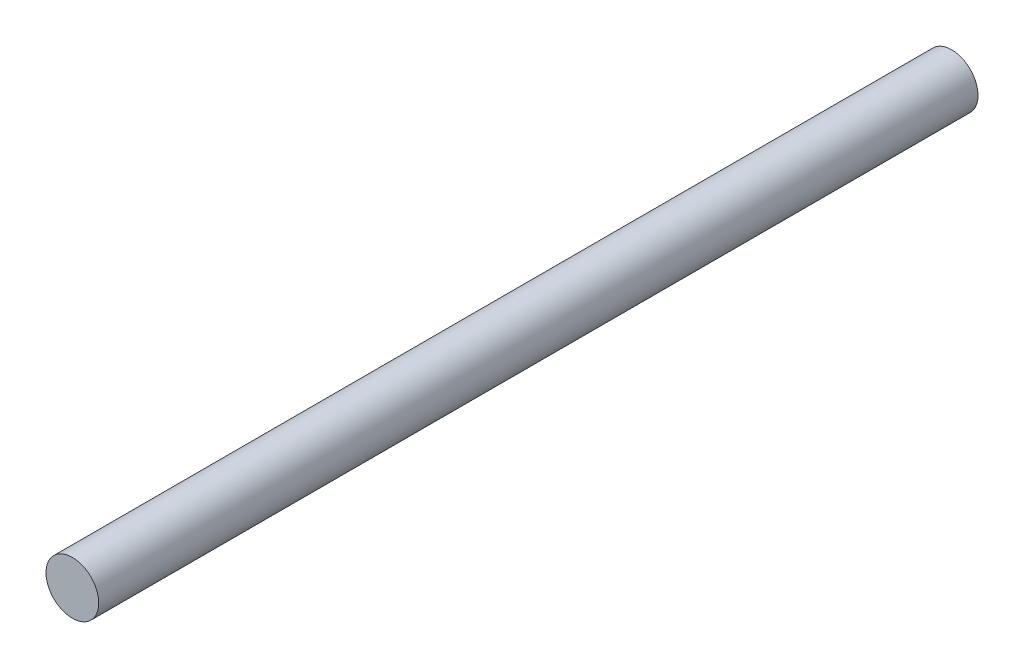
from build123d import *

# Parameters (mm, degrees)
SKETCH2_R           = 0.75
BOSS_EXTRUDE2_DEPTH = 25


with BuildPart() as part:
    # Sketch2 → Boss-Extrude2 (new body)
    with BuildSketch(Plane(origin=(0, 0, -1433.083557664), x_dir=(-1, 0, 0), z_dir=(0, 0, -1))):
        with Locations(Location((0, 0, 0), (0, 0, 90))):
            Circle(SKETCH2_R)
    extrude(amount=BOSS_EXTRUDE2_DEPTH)


solid = part.part
